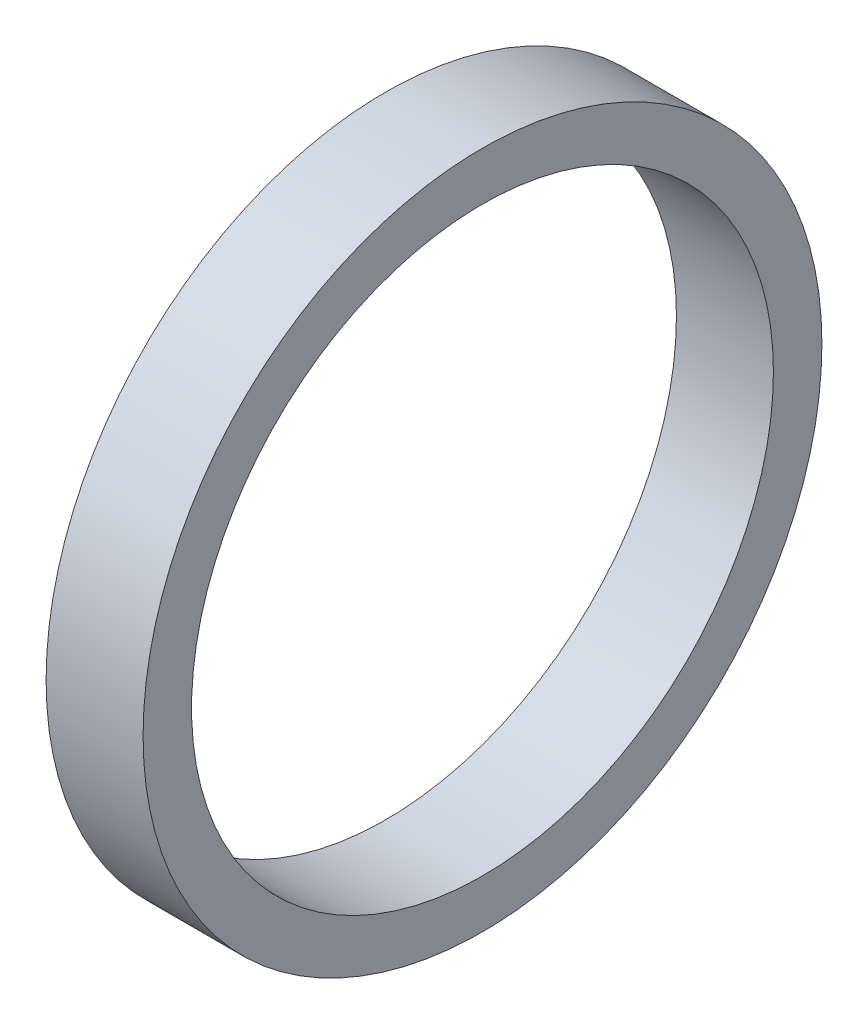
from build123d import *

# Parameters (mm, degrees)
SKETCH1_R           = 7
SKETCH1_R_2         = 6
BOSS_EXTRUDE1_DEPTH = 2


with BuildPart() as part:
    # Sketch1 → Boss-Extrude1 (new body)
    with BuildSketch(Plane(origin=(0, 0, 0), x_dir=(0, 0, -1), z_dir=(1, 0, 0))):
        Circle(SKETCH1_R)
        Circle(SKETCH1_R_2, mode=Mode.SUBTRACT)
    extrude(amount=BOSS_EXTRUDE1_DEPTH)


solid = part.part
